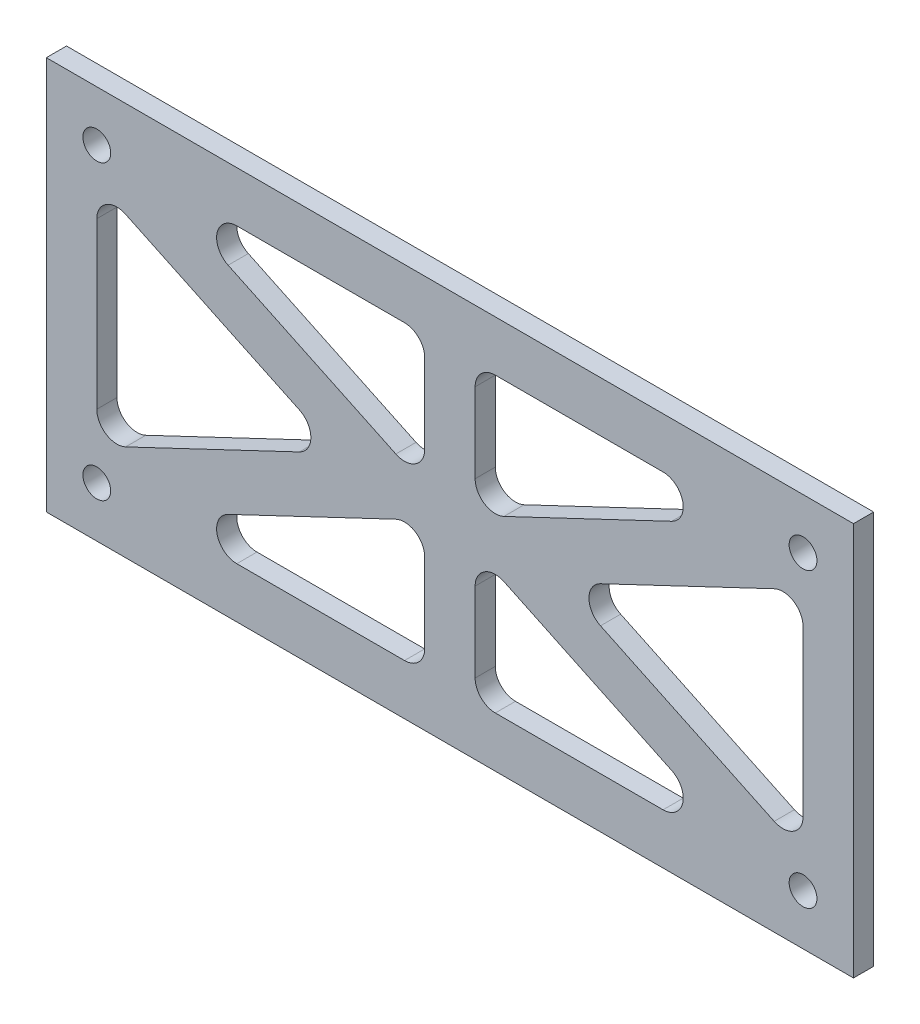
from build123d import *

# Parameters (mm, degrees)
SKETCH1_R           = 1.75006
SKETCH1_R_2         = 1.750059992
BOSS_EXTRUDE1_DEPTH = 2.54


with BuildPart() as part:
    # Sketch1 → Boss-Extrude1 (new body)
    with BuildSketch(Plane.XY):
        Polygon((2.54, 0), (99.06, 0), (101.6, 0), (101.6, 2.54), (101.6, 46.99), (101.6, 49.53), (99.06, 49.53), (2.54, 49.53), (0, 49.53), (0, 46.99), (0, 2.54), (0, 0), align=None)
        with Locations((6.35, 43.18)):
            Circle(SKETCH1_R, mode=Mode.SUBTRACT)
        with Locations(Location((6.35, 6.35, 0), (0, 0, 180))):
            Circle(SKETCH1_R, mode=Mode.SUBTRACT)
        with Locations((95.25, 6.35)):
            Circle(SKETCH1_R, mode=Mode.SUBTRACT)
        with Locations(Location((95.25, 43.18, 0), (0, 0, 180))):
            Circle(SKETCH1_R_2, mode=Mode.SUBTRACT)
        with BuildLine():
            Line((22.882222071, 38.345496006), (43.995572894, 28.320908231))
            ThreePointArc((43.995572894, 28.320908231), (46.442286843, 28.46846732), (47.625, 30.615412225))
            Line((47.625, 30.615412225), (47.625, 40.64))
            ThreePointArc((47.625, 40.64), (46.881051224, 42.436051224), (45.085, 43.18))
            Line((45.085, 43.18), (23.971649177, 43.18))
            ThreePointArc((23.971649177, 43.18), (21.493783145, 41.19837257), (22.882222071, 38.345496006))
        make_face(mode=Mode.SUBTRACT)
        with BuildLine():
            Line((47.625, 18.914587775), (47.625, 8.89))
            ThreePointArc((47.625, 8.89), (46.881051224, 7.093948776), (45.085, 6.35))
            Line((45.085, 6.35), (23.971649177, 6.35))
            ThreePointArc((23.971649177, 6.35), (21.493783145, 8.33162743), (22.882222071, 11.184503994))
            Line((22.882222071, 11.184503994), (43.995572894, 21.209091769))
            ThreePointArc((43.995572894, 21.209091769), (46.442286843, 21.06153268), (47.625, 18.914587775))
        make_face(mode=Mode.SUBTRACT)
        with BuildLine():
            Line((78.717777929, 11.184503994), (57.604427106, 21.209091769))
            ThreePointArc((57.604427106, 21.209091769), (55.157713157, 21.06153268), (53.975, 18.914587775))
            Line((53.975, 18.914587775), (53.975, 8.89))
            ThreePointArc((53.975, 8.89), (54.718948776, 7.093948776), (56.515, 6.35))
            Line((56.515, 6.35), (77.628350823, 6.35))
            ThreePointArc((77.628350823, 6.35), (80.106216855, 8.33162743), (78.717777929, 11.184503994))
        make_face(mode=Mode.SUBTRACT)
        with BuildLine():
            Line((53.975, 30.615412225), (53.975, 40.64))
            ThreePointArc((53.975, 40.64), (54.718948776, 42.436051224), (56.515, 43.18))
            Line((56.515, 43.18), (77.628350823, 43.18))
            ThreePointArc((77.628350823, 43.18), (80.106216855, 41.19837257), (78.717777929, 38.345496006))
            Line((78.717777929, 38.345496006), (57.604427106, 28.320908231))
            ThreePointArc((57.604427106, 28.320908231), (55.157713157, 28.46846732), (53.975, 30.615412225))
        make_face(mode=Mode.SUBTRACT)
        with BuildLine():
            Line((9.979427106, 37.442318053), (31.847258551, 27.059503994))
            ThreePointArc((31.847258551, 27.059503994), (33.297831444, 24.765), (31.847258551, 22.470496006))
            Line((31.847258551, 22.470496006), (9.979427106, 12.087681947))
            ThreePointArc((9.979427106, 12.087681947), (7.532713157, 12.235241036), (6.35, 14.382185941))
            Line((6.35, 14.382185941), (6.35, 35.147814059))
            ThreePointArc((6.35, 35.147814059), (7.532713157, 37.294758964), (9.979427106, 37.442318053))
        make_face(mode=Mode.SUBTRACT)
        with BuildLine():
            Line((91.620572894, 12.087681947), (69.752741449, 22.470496006))
            ThreePointArc((69.752741449, 22.470496006), (68.302168556, 24.765), (69.752741449, 27.059503994))
            Line((69.752741449, 27.059503994), (91.620572894, 37.442318053))
            ThreePointArc((91.620572894, 37.442318053), (94.067286843, 37.294758964), (95.25, 35.147814059))
            Line((95.25, 35.147814059), (95.25, 14.382185941))
            ThreePointArc((95.25, 14.382185941), (94.067286843, 12.235241036), (91.620572894, 12.087681947))
        make_face(mode=Mode.SUBTRACT)
    extrude(amount=BOSS_EXTRUDE1_DEPTH)


solid = part.part
